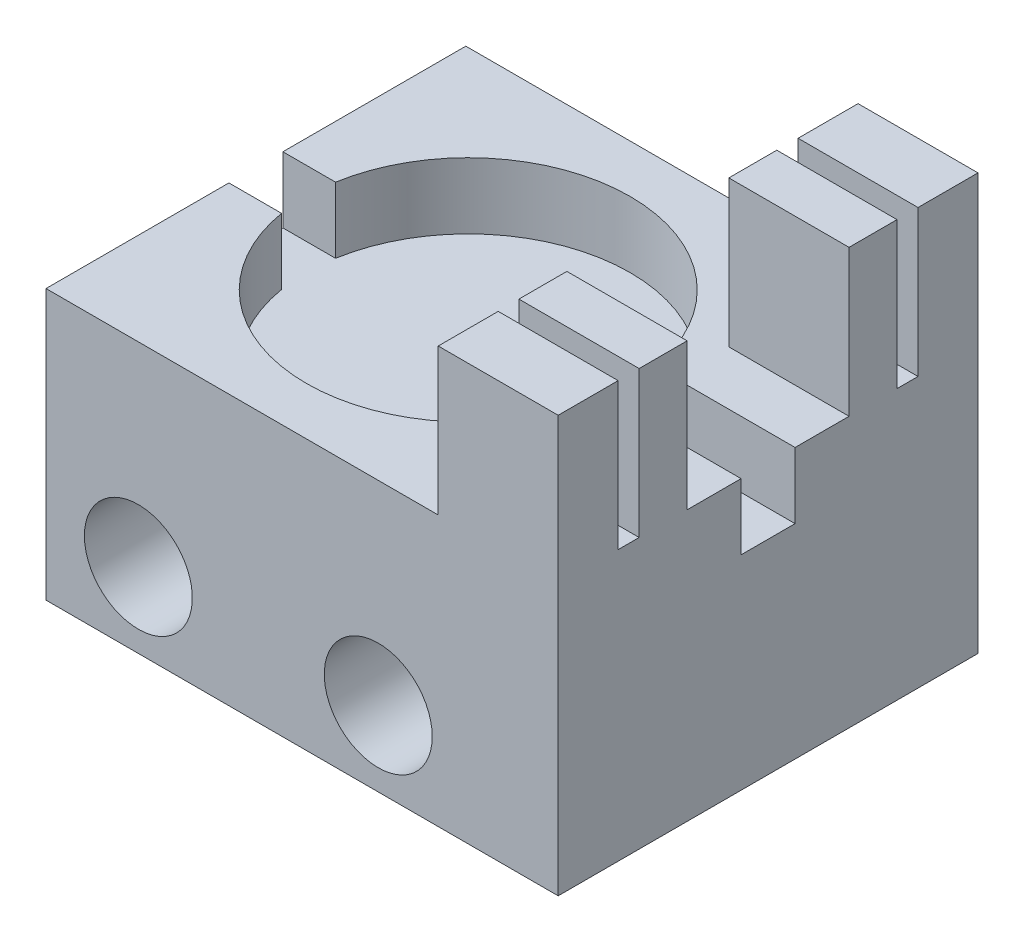
from build123d import *

# Parameters (mm, degrees)
SKETCH1_W           = 50
SKETCH1_H           = 22.5
BOSS_EXTRUDE1_DEPTH = 35
SKETCH2_R           = 4.5
CUT_EXTRUDE1_DEPTH  = 35
CUT_EXTRUDE2_DEPTH  = 5.5
SKETCH4_W           = 10
SKETCH4_H           = 5
SKETCH4_W_2         = 10.024005515
SKETCH4_H_2         = 4
BOSS_EXTRUDE2_DEPTH = 12.2
SKETCH5_W           = 7.3
SKETCH5_H           = 22.5
CUT_EXTRUDE3_DEPTH  = 49.98879974


with BuildPart() as part:
    # Sketch1 → Boss-Extrude1 (new body)
    with BuildSketch(Plane.XY):
        Rectangle(SKETCH1_W, SKETCH1_H)
    extrude(amount=BOSS_EXTRUDE1_DEPTH)

    # Sketch2 → Cut-Extrude1 (cut)
    with BuildSketch(Plane.XY.offset(35)):
        with Locations((10, -5)):
            Circle(SKETCH2_R)
        with Locations(Location((-10, -5, 0), (0, 0, 180))):
            Circle(SKETCH2_R)
    extrude(amount=-CUT_EXTRUDE1_DEPTH, mode=Mode.SUBTRACT)

    # Sketch3 → Cut-Extrude2 (cut)
    with BuildSketch(Plane(origin=(0, 11.25, 0), x_dir=(1, 0, 0), z_dir=(0, 1, 0))):
        with BuildLine():
            Line((25, -19.75), (13.311179512, -19.75))
            ThreePointArc((13.311179512, -19.75), (0, -31), (-13.311179512, -19.75))
            Line((-13.311179512, -19.75), (-25, -19.75))
            Line((-25, -19.75), (-25, -15.25))
            Line((-25, -15.25), (-13.311179512, -15.25))
            ThreePointArc((-13.311179512, -15.25), (0, -4), (13.311179512, -15.25))
            Line((13.311179512, -15.25), (25, -15.25))
            Line((25, -15.25), (25, -19.75))
        make_face()
    extrude(amount=-CUT_EXTRUDE2_DEPTH, mode=Mode.SUBTRACT)

    # Sketch4 → Boss-Extrude2 (add)
    with BuildSketch(Plane(origin=(0, 11.25, 0), x_dir=(1, 0, 0), z_dir=(0, 1, 0))):
        with Locations((20, -2.5)):
            Rectangle(SKETCH4_W, SKETCH4_H)
        with Locations((19.987997243, -8.75)):
            Rectangle(SKETCH4_W_2, SKETCH4_H_2)
        with Locations((19.987997243, -26.25)):
            Rectangle(SKETCH4_W_2, SKETCH4_H_2)
        with Locations((20, -32.5)):
            Rectangle(SKETCH4_W, SKETCH4_H)
    extrude(amount=BOSS_EXTRUDE2_DEPTH)

    # Sketch5 → Cut-Extrude3 (cut, through all)
    with BuildSketch(Plane(origin=(0, 0, 0), x_dir=(-1, 0, 0), z_dir=(0, 0, -1))):
        with Locations((21.35, 0)):
            Rectangle(SKETCH5_W, SKETCH5_H)
    extrude(amount=-CUT_EXTRUDE3_DEPTH, mode=Mode.SUBTRACT)


solid = part.part
